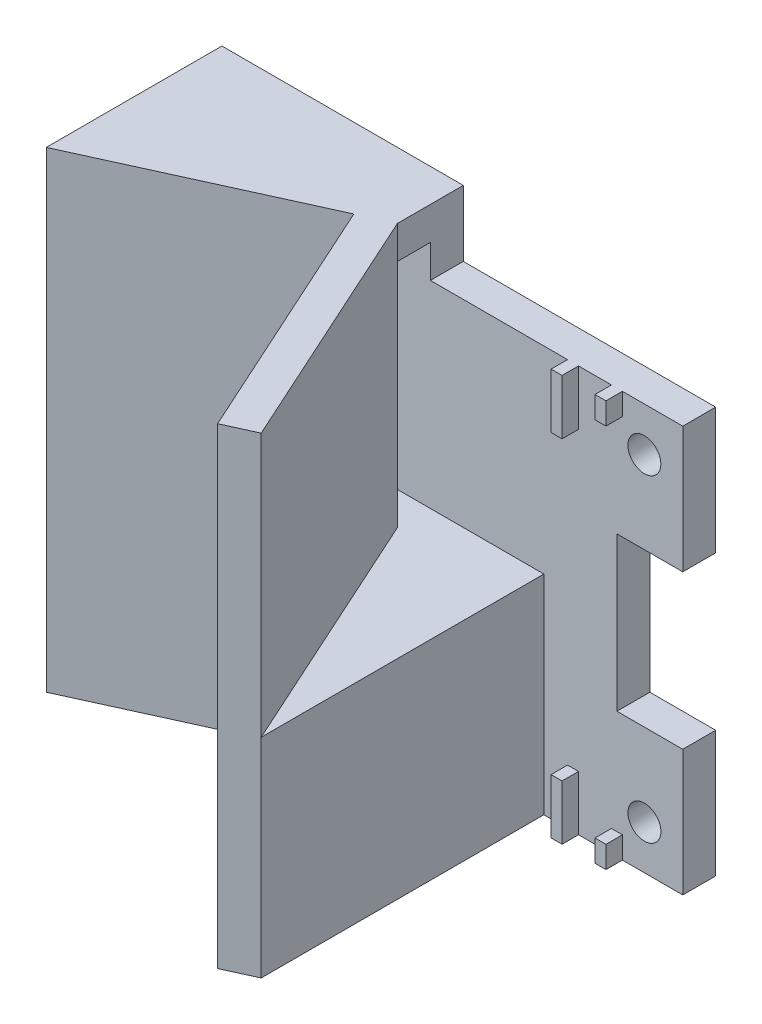
from build123d import *

# Parameters (mm, degrees)
CROQUIS1_R              = 1.5
SALIENTE_EXTRUIR1_DEPTH = 3
CROQUIS3_W              = 22
CROQUIS3_H              = 37
SALIENTE_EXTRUIR2_DEPTH = 13
CORTAR_EXTRUIR1_START   = -37
CORTAR_EXTRUIR1_DEPTH   = 37
SALIENTE_EXTRUIR4_DEPTH = 6
CROQUIS7_W              = 3.002058729
CROQUIS7_H              = 21
CORTAR_EXTRUIR2_DEPTH   = 22
CROQUIS8_W              = 3
CROQUIS8_H              = 43
SALIENTE_EXTRUIR5_DEPTH = 25
SALIENTE_EXTRUIR6_START = -19
SALIENTE_EXTRUIR6_DEPTH = 19
CROQUIS13_W             = 1
CROQUIS13_H             = 2
CROQUIS13_H_2           = 5
SALIENTE_EXTRUIR8_DEPTH = 1.5


with BuildPart() as part:
    # Croquis1 → Saliente-Extruir1 (new body)
    with BuildSketch(Plane.XY):
        with BuildLine():
            Line((-4.197309417, 33.461883408), (-52.197309417, 33.461883408))
            ThreePointArc((-52.197309417, 33.461883408), (-55.025736542, 32.290310533), (-56.197309417, 29.461883408))
            Line((-56.197309417, 29.461883408), (-56.197309417, 24.961883408))
            Line((-56.197309417, 24.961883408), (-49.197309417, 24.961883408))
            Line((-49.197309417, 24.961883408), (-49.197309417, 4.961883408))
            Line((-49.197309417, 4.961883408), (-56.197309417, 4.961883408))
            Line((-56.197309417, 4.961883408), (-56.197309417, 0.461883408))
            ThreePointArc((-56.197309417, 0.461883408), (-55.099110766, -2.293519818), (-52.406664651, -3.538116592))
            Line((-52.406664651, -3.538116592), (-4.197309417, -3.538116592))
            Line((-4.197309417, -3.538116592), (-4.197309417, 7.961883408))
            Line((-4.197309417, 7.961883408), (-10.197309417, 7.961883408))
            Line((-10.197309417, 7.961883408), (-10.197309417, 21.961883408))
            Line((-10.197309417, 21.961883408), (-4.197309417, 21.961883408))
            Line((-4.197309417, 21.961883408), (-4.197309417, 33.461883408))
        make_face()
        with Locations((-52.19152813, 0.461883408)):
            Circle(CROQUIS1_R, mode=Mode.SUBTRACT)
        with Locations((-7.69152813, 0.461883408)):
            Circle(CROQUIS1_R, mode=Mode.SUBTRACT)
        with Locations((-52.197309417, 29.461883408)):
            Circle(CROQUIS1_R, mode=Mode.SUBTRACT)
        with Locations((-7.697309417, 29.461882832)):
            Circle(CROQUIS1_R, mode=Mode.SUBTRACT)
    extrude(amount=SALIENTE_EXTRUIR1_DEPTH)

    # Croquis3 → Saliente-Extruir2 (add)
    with BuildSketch(Plane.XY.offset(3)):
        with Locations((-38.197309417, 14.961883408)):
            Rectangle(CROQUIS3_W, CROQUIS3_H)
    extrude(amount=SALIENTE_EXTRUIR2_DEPTH)

    # Croquis4 → Cortar-Extruir1 (cut)
    with BuildSketch(Plane.XZ.offset(3.538116592).offset(CORTAR_EXTRUIR1_START)):
        Polygon((-27.197309417, 16), (-27.197309417, 6.002058729), (-49.197309417, 16), align=None)
    extrude(amount=CORTAR_EXTRUIR1_DEPTH, mode=Mode.SUBTRACT)

    # Croquis6 → Saliente-Extruir4 (add)
    with BuildSketch(Plane(origin=(0, 33.461883408, 0), x_dir=(1, 0, 0), z_dir=(0, 1, 0))):
        Polygon((-27.197309417, -6.002058729), (-49.197309417, -16), (-49.197309417, 0), (-27.197309417, 0), align=None)
    extrude(amount=SALIENTE_EXTRUIR4_DEPTH)

    # Croquis7 → Cortar-Extruir2 (cut)
    with BuildSketch(Plane(origin=(-27.197309417, 0, 0), x_dir=(0, 0, -1), z_dir=(1, 0, 0))):
        with Locations((-4.501029365, 25.961883408)):
            Rectangle(CROQUIS7_W, CROQUIS7_H)
    extrude(amount=-CORTAR_EXTRUIR2_DEPTH, mode=Mode.SUBTRACT)

    # Croquis8 → Saliente-Extruir5 (add)
    with BuildSketch(Plane(origin=(-2.394740987, 0, -5.269515022), x_dir=(0.9103985682863143, 0, -0.4137323372208525), z_dir=(0.4137323372208525, 0, 0.9103985682863143))):
        with Locations((-28.743637341, 17.961883408)):
            Rectangle(CROQUIS8_W, CROQUIS8_H)
    extrude(amount=SALIENTE_EXTRUIR5_DEPTH)

    # Croquis9 → Saliente-Extruir6 (add)
    with BuildSketch(Plane.XZ.offset(3.538116592).offset(SALIENTE_EXTRUIR6_START)):
        Polygon((-16.854000987, 28.762022936), (-27.197309417, 6.002058729), (-27.197309417, 3), (-16.854000987, 3), align=None)
    extrude(amount=SALIENTE_EXTRUIR6_DEPTH)

    # Croquis13 → Saliente-Extruir8 (add)
    with BuildSketch(Plane.XY.offset(3)):
        with Locations((-10.197309417, -2.538116592)):
            Rectangle(CROQUIS13_W, CROQUIS13_H)
        with Locations((-10.197309417, 32.461883408)):
            Rectangle(CROQUIS13_W, CROQUIS13_H)
        with Locations((-14.197309417, 30.961883408)):
            Rectangle(CROQUIS13_W, CROQUIS13_H_2)
        with Locations((-14.197309417, -1.038116592)):
            Rectangle(CROQUIS13_W, CROQUIS13_H_2)
    extrude(amount=SALIENTE_EXTRUIR8_DEPTH)


solid = part.part
